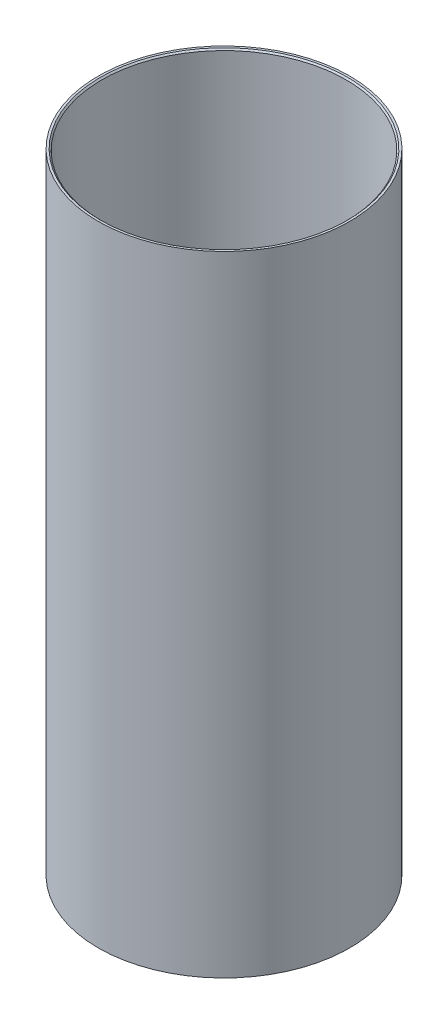
from build123d import *

# Parameters (mm, degrees)
SKETCH1_R           = 17.5
BOSS_EXTRUDE1_DEPTH = 87.5
SKETCH2_R           = 17
CUT_EXTRUDE1_DEPTH  = 91.932667397
CHAMFER1_SIZE       = 0.2


with BuildPart() as part:
    # Sketch1 → Boss-Extrude1 (new body)
    with BuildSketch(Plane(origin=(0, 0, 0), x_dir=(1, 0, 0), z_dir=(0, 1, 0))):
        with Locations(Location((0, 0, 0), (0, 0, 270))):
            Circle(SKETCH1_R)
    extrude(amount=BOSS_EXTRUDE1_DEPTH)

    # Sketch2 → Cut-Extrude1 (cut, through all)
    with BuildSketch(Plane(origin=(0, 87.5, 0), x_dir=(1, 0, 0), z_dir=(0, 1, 0))):
        with Locations(Location((0, 0, 0), (0, 0, 270))):
            Circle(SKETCH2_R)
    extrude(amount=-CUT_EXTRUDE1_DEPTH, mode=Mode.SUBTRACT)

    # Chamfer1
    chamfer1_edges = [part.edges().sort_by_distance(p)[0] for p in [
        (0, 0, -17),
        (0, 87.5, -17),
    ]]
    chamfer(chamfer1_edges, length=CHAMFER1_SIZE)


solid = part.part
